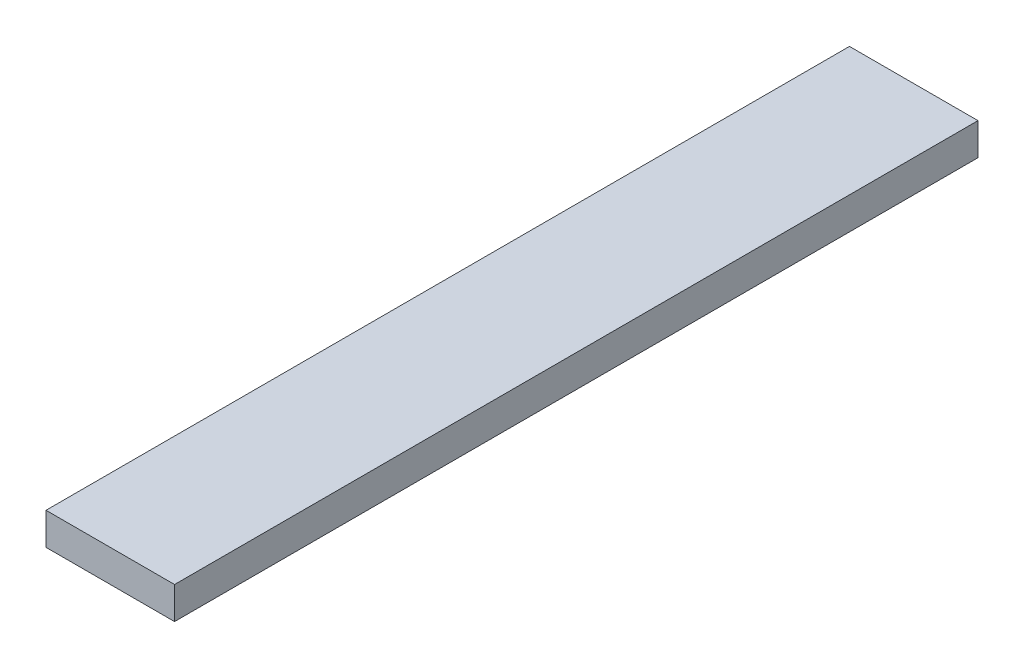
from build123d import *

# Parameters (mm, degrees)
SKETCH1_W           = 304.8
SKETCH1_H           = 304.8
BOSS_EXTRUDE1_DEPTH = 6.35
CUT_EXTRUDE2_DEPTH  = 6.35


with BuildPart() as part:
    # Sketch1 → Boss-Extrude1 (new body)
    with BuildSketch(Plane(origin=(0, 0, 0), x_dir=(1, 0, 0), z_dir=(0, 1, 0))):
        with Locations((152.4, 152.4)):
            Rectangle(SKETCH1_W, SKETCH1_H)
    extrude(amount=BOSS_EXTRUDE1_DEPTH)

    # Sketch2 → Cut-Extrude2 (cut)
    with BuildSketch(Plane(origin=(0, 6.35, 0), x_dir=(1, 0, 0), z_dir=(0, 1, 0))):
        Polygon((25.4, 304.8), (25.4, 146.05), (0, 146.05), (0, 0), (304.8, 0), (304.8, 304.8), align=None)
    extrude(amount=-CUT_EXTRUDE2_DEPTH, mode=Mode.SUBTRACT)


solid = part.part
